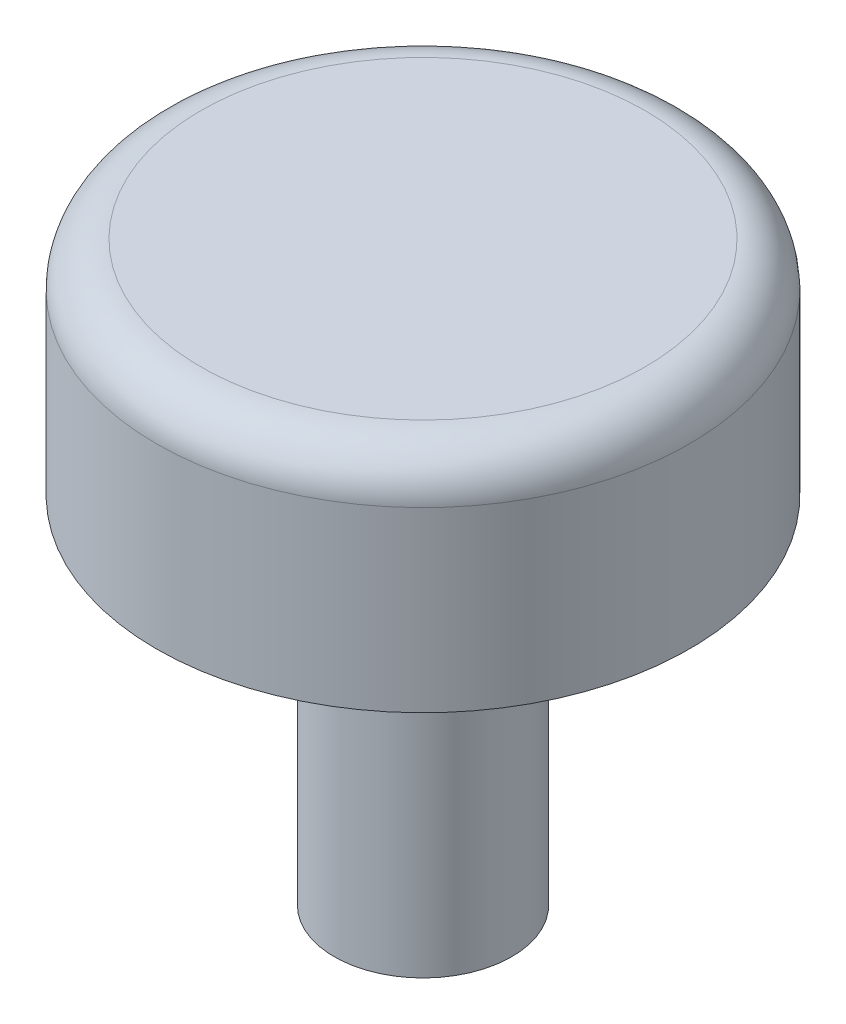
from build123d import *


with BuildPart() as part:
    # Sketch1 → Revolve1 (revolve)
    with BuildSketch(Plane(origin=(0, 0, 0), x_dir=(0, 0, -1), z_dir=(1, 0, 0))):
        with BuildLine():
            Line((0, 0), (0, 13))
            Line((0, 13), (5, 13))
            ThreePointArc((5, 13), (5.707106781, 12.707106781), (6, 12))
            Line((6, 12), (6, 8))
            Line((6, 8), (2, 8))
            Line((2, 8), (2, 0))
            Line((2, 0), (0, 0))
        make_face()
    revolve(axis=Axis((0, 0, 0), (0, 1, 0)))


solid = part.part
